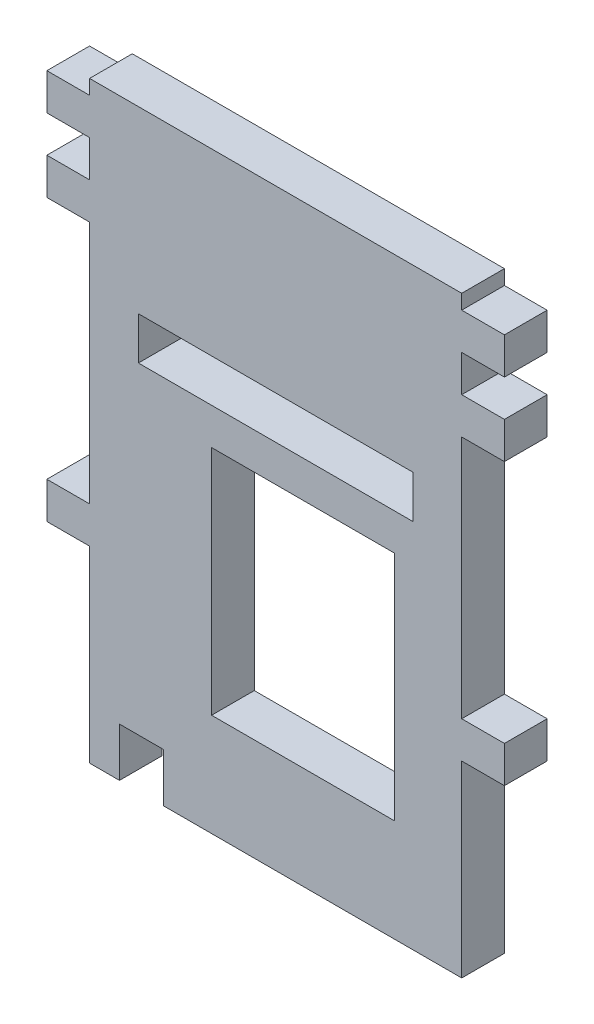
from build123d import *

# Parameters (mm, degrees)
PROFILE_LASER_PROFILE_3P5_W   = 22.5
PROFILE_LASER_PROFILE_3P5_H   = 3.5
PROFILE_LASER_PROFILE_3P5_W_2 = 15
PROFILE_LASER_PROFILE_3P5_H_2 = 19
LASER_PROFILE_3P5_DEPTH       = 3.5


with BuildPart() as part:
    # Profile_Laser_profile_3p5 → Laser_profile_3p5 (new body)
    with BuildSketch(Plane.XY):
        Polygon((0, -42.4), (2.45, -42.4), (2.45, -38.401), (6.05, -38.401), (6.05, -42.4), (30.5, -42.4), (30.5, -27), (34, -27), (34, -24), (30.5, -24), (30.5, -4), (34, -4), (34, -1), (30.5, -1), (30.5, 2), (34, 2), (34, 5), (30.5, 5), (30.5, 6.2), (0, 6.2), (0, 5), (-3.5, 5), (-3.5, 2), (0, 2), (0, -1), (-3.5, -1), (-3.5, -4), (0, -4), (0, -24), (-3.5, -24), (-3.5, -27), (0, -27), align=None)
        with Locations((15.25, -10.25)):
            Rectangle(PROFILE_LASER_PROFILE_3P5_W, PROFILE_LASER_PROFILE_3P5_H, mode=Mode.SUBTRACT)
        with Locations((17.5, -24.5)):
            Rectangle(PROFILE_LASER_PROFILE_3P5_W_2, PROFILE_LASER_PROFILE_3P5_H_2, mode=Mode.SUBTRACT)
    extrude(amount=LASER_PROFILE_3P5_DEPTH)


solid = part.part
